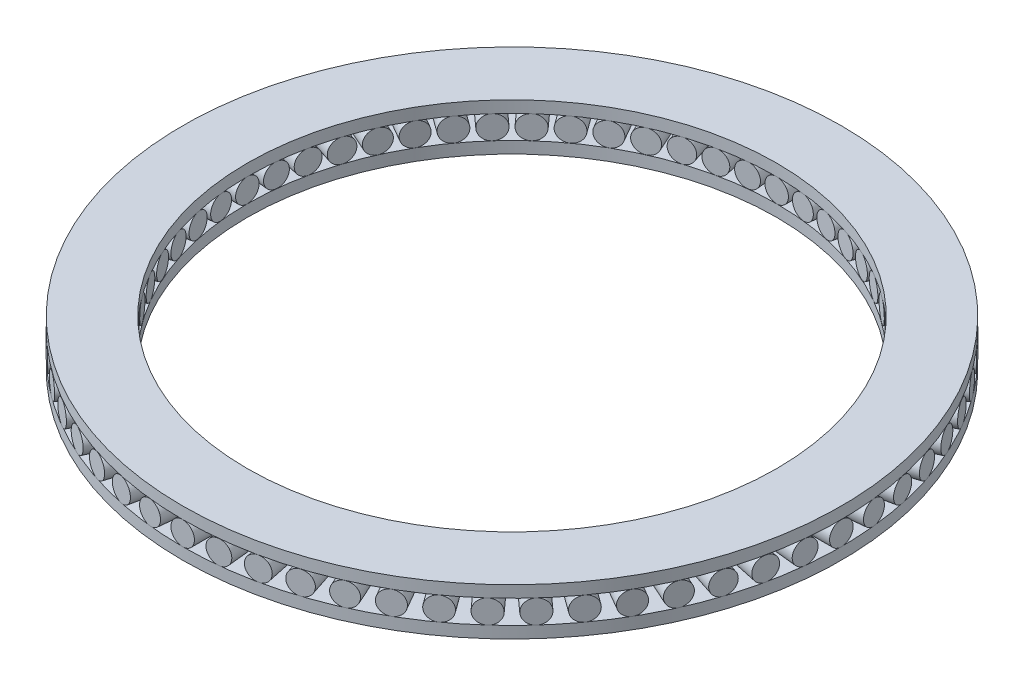
from build123d import *

# Parameters (mm, degrees)
SKETCH_1_R               = 28
SKETCH_1_R_2             = 22.5
EXTRUDE_1_DEPTH          = 1
EXTRUDE_START            = 22.5
SKETCH_2_R               = 1
EXTRUDE_2_DEPTH          = 5.5
PATTERN_CIRCULAR_3_COUNT = 60
EXTRUDE_START_2          = -3
SKETCH_3_R               = 28
SKETCH_3_R_2             = 22.5
EXTRUDE_3_DEPTH          = 1


with BuildPart() as part:
    # 草图1 → 凸台-拉伸1 (new body)
    with BuildSketch(Plane(origin=(0, 0, 0), x_dir=(1, 0, 0), z_dir=(0, 1, 0))):
        with Locations(Location((0, 0, 0), (0, 0, 270))):
            Circle(SKETCH_1_R)
        with Locations(Location((0, 0, 0), (0, 0, 270))):
            Circle(SKETCH_1_R_2, mode=Mode.SUBTRACT)
    extrude(amount=EXTRUDE_1_DEPTH)


with BuildPart() as body_2:
    # 草图2 → 凸台-拉伸2 (new body)
    with BuildSketch(Plane.XY.offset(EXTRUDE_START)):
        with Locations((0, 2)):
            Circle(SKETCH_2_R)
    extrude(amount=EXTRUDE_2_DEPTH)


with BuildPart() as pattern_circular_3_1:
    # 阵列(圆周)3: pattern copy
    add(body_2.part.rotate(Axis((0, 0, 0), (0, 1, 0)), 1 * 360 / PATTERN_CIRCULAR_3_COUNT))


with BuildPart() as pattern_circular_3_2:
    # 阵列(圆周)3: pattern copy
    add(body_2.part.rotate(Axis((0, 0, 0), (0, 1, 0)), 2 * 360 / PATTERN_CIRCULAR_3_COUNT))


with BuildPart() as pattern_circular_3_3:
    # 阵列(圆周)3: pattern copy
    add(body_2.part.rotate(Axis((0, 0, 0), (0, 1, 0)), 3 * 360 / PATTERN_CIRCULAR_3_COUNT))


with BuildPart() as pattern_circular_3_4:
    # 阵列(圆周)3: pattern copy
    add(body_2.part.rotate(Axis((0, 0, 0), (0, 1, 0)), 4 * 360 / PATTERN_CIRCULAR_3_COUNT))


with BuildPart() as pattern_circular_3_5:
    # 阵列(圆周)3: pattern copy
    add(body_2.part.rotate(Axis((0, 0, 0), (0, 1, 0)), 5 * 360 / PATTERN_CIRCULAR_3_COUNT))


with BuildPart() as pattern_circular_3_6:
    # 阵列(圆周)3: pattern copy
    add(body_2.part.rotate(Axis((0, 0, 0), (0, 1, 0)), 6 * 360 / PATTERN_CIRCULAR_3_COUNT))


with BuildPart() as pattern_circular_3_7:
    # 阵列(圆周)3: pattern copy
    add(body_2.part.rotate(Axis((0, 0, 0), (0, 1, 0)), 7 * 360 / PATTERN_CIRCULAR_3_COUNT))


with BuildPart() as pattern_circular_3_8:
    # 阵列(圆周)3: pattern copy
    add(body_2.part.rotate(Axis((0, 0, 0), (0, 1, 0)), 8 * 360 / PATTERN_CIRCULAR_3_COUNT))


with BuildPart() as pattern_circular_3_9:
    # 阵列(圆周)3: pattern copy
    add(body_2.part.rotate(Axis((0, 0, 0), (0, 1, 0)), 9 * 360 / PATTERN_CIRCULAR_3_COUNT))


with BuildPart() as pattern_circular_3_10:
    # 阵列(圆周)3: pattern copy
    add(body_2.part.rotate(Axis((0, 0, 0), (0, 1, 0)), 10 * 360 / PATTERN_CIRCULAR_3_COUNT))


with BuildPart() as pattern_circular_3_11:
    # 阵列(圆周)3: pattern copy
    add(body_2.part.rotate(Axis((0, 0, 0), (0, 1, 0)), 11 * 360 / PATTERN_CIRCULAR_3_COUNT))


with BuildPart() as pattern_circular_3_12:
    # 阵列(圆周)3: pattern copy
    add(body_2.part.rotate(Axis((0, 0, 0), (0, 1, 0)), 12 * 360 / PATTERN_CIRCULAR_3_COUNT))


with BuildPart() as pattern_circular_3_13:
    # 阵列(圆周)3: pattern copy
    add(body_2.part.rotate(Axis((0, 0, 0), (0, 1, 0)), 13 * 360 / PATTERN_CIRCULAR_3_COUNT))


with BuildPart() as pattern_circular_3_14:
    # 阵列(圆周)3: pattern copy
    add(body_2.part.rotate(Axis((0, 0, 0), (0, 1, 0)), 14 * 360 / PATTERN_CIRCULAR_3_COUNT))


with BuildPart() as pattern_circular_3_15:
    # 阵列(圆周)3: pattern copy
    add(body_2.part.rotate(Axis((0, 0, 0), (0, 1, 0)), 15 * 360 / PATTERN_CIRCULAR_3_COUNT))


with BuildPart() as pattern_circular_3_16:
    # 阵列(圆周)3: pattern copy
    add(body_2.part.rotate(Axis((0, 0, 0), (0, 1, 0)), 16 * 360 / PATTERN_CIRCULAR_3_COUNT))


with BuildPart() as pattern_circular_3_17:
    # 阵列(圆周)3: pattern copy
    add(body_2.part.rotate(Axis((0, 0, 0), (0, 1, 0)), 17 * 360 / PATTERN_CIRCULAR_3_COUNT))


with BuildPart() as pattern_circular_3_18:
    # 阵列(圆周)3: pattern copy
    add(body_2.part.rotate(Axis((0, 0, 0), (0, 1, 0)), 18 * 360 / PATTERN_CIRCULAR_3_COUNT))


with BuildPart() as pattern_circular_3_19:
    # 阵列(圆周)3: pattern copy
    add(body_2.part.rotate(Axis((0, 0, 0), (0, 1, 0)), 19 * 360 / PATTERN_CIRCULAR_3_COUNT))


with BuildPart() as pattern_circular_3_20:
    # 阵列(圆周)3: pattern copy
    add(body_2.part.rotate(Axis((0, 0, 0), (0, 1, 0)), 20 * 360 / PATTERN_CIRCULAR_3_COUNT))


with BuildPart() as pattern_circular_3_21:
    # 阵列(圆周)3: pattern copy
    add(body_2.part.rotate(Axis((0, 0, 0), (0, 1, 0)), 21 * 360 / PATTERN_CIRCULAR_3_COUNT))


with BuildPart() as pattern_circular_3_22:
    # 阵列(圆周)3: pattern copy
    add(body_2.part.rotate(Axis((0, 0, 0), (0, 1, 0)), 22 * 360 / PATTERN_CIRCULAR_3_COUNT))


with BuildPart() as pattern_circular_3_23:
    # 阵列(圆周)3: pattern copy
    add(body_2.part.rotate(Axis((0, 0, 0), (0, 1, 0)), 23 * 360 / PATTERN_CIRCULAR_3_COUNT))


with BuildPart() as pattern_circular_3_24:
    # 阵列(圆周)3: pattern copy
    add(body_2.part.rotate(Axis((0, 0, 0), (0, 1, 0)), 24 * 360 / PATTERN_CIRCULAR_3_COUNT))


with BuildPart() as pattern_circular_3_25:
    # 阵列(圆周)3: pattern copy
    add(body_2.part.rotate(Axis((0, 0, 0), (0, 1, 0)), 25 * 360 / PATTERN_CIRCULAR_3_COUNT))


with BuildPart() as pattern_circular_3_26:
    # 阵列(圆周)3: pattern copy
    add(body_2.part.rotate(Axis((0, 0, 0), (0, 1, 0)), 26 * 360 / PATTERN_CIRCULAR_3_COUNT))


with BuildPart() as pattern_circular_3_27:
    # 阵列(圆周)3: pattern copy
    add(body_2.part.rotate(Axis((0, 0, 0), (0, 1, 0)), 27 * 360 / PATTERN_CIRCULAR_3_COUNT))


with BuildPart() as pattern_circular_3_28:
    # 阵列(圆周)3: pattern copy
    add(body_2.part.rotate(Axis((0, 0, 0), (0, 1, 0)), 28 * 360 / PATTERN_CIRCULAR_3_COUNT))


with BuildPart() as pattern_circular_3_29:
    # 阵列(圆周)3: pattern copy
    add(body_2.part.rotate(Axis((0, 0, 0), (0, 1, 0)), 29 * 360 / PATTERN_CIRCULAR_3_COUNT))


with BuildPart() as pattern_circular_3_30:
    # 阵列(圆周)3: pattern copy
    add(body_2.part.rotate(Axis((0, 0, 0), (0, 1, 0)), 30 * 360 / PATTERN_CIRCULAR_3_COUNT))


with BuildPart() as pattern_circular_3_31:
    # 阵列(圆周)3: pattern copy
    add(body_2.part.rotate(Axis((0, 0, 0), (0, 1, 0)), 31 * 360 / PATTERN_CIRCULAR_3_COUNT))


with BuildPart() as pattern_circular_3_32:
    # 阵列(圆周)3: pattern copy
    add(body_2.part.rotate(Axis((0, 0, 0), (0, 1, 0)), 32 * 360 / PATTERN_CIRCULAR_3_COUNT))


with BuildPart() as pattern_circular_3_33:
    # 阵列(圆周)3: pattern copy
    add(body_2.part.rotate(Axis((0, 0, 0), (0, 1, 0)), 33 * 360 / PATTERN_CIRCULAR_3_COUNT))


with BuildPart() as pattern_circular_3_34:
    # 阵列(圆周)3: pattern copy
    add(body_2.part.rotate(Axis((0, 0, 0), (0, 1, 0)), 34 * 360 / PATTERN_CIRCULAR_3_COUNT))


with BuildPart() as pattern_circular_3_35:
    # 阵列(圆周)3: pattern copy
    add(body_2.part.rotate(Axis((0, 0, 0), (0, 1, 0)), 35 * 360 / PATTERN_CIRCULAR_3_COUNT))


with BuildPart() as pattern_circular_3_36:
    # 阵列(圆周)3: pattern copy
    add(body_2.part.rotate(Axis((0, 0, 0), (0, 1, 0)), 36 * 360 / PATTERN_CIRCULAR_3_COUNT))


with BuildPart() as pattern_circular_3_37:
    # 阵列(圆周)3: pattern copy
    add(body_2.part.rotate(Axis((0, 0, 0), (0, 1, 0)), 37 * 360 / PATTERN_CIRCULAR_3_COUNT))


with BuildPart() as pattern_circular_3_38:
    # 阵列(圆周)3: pattern copy
    add(body_2.part.rotate(Axis((0, 0, 0), (0, 1, 0)), 38 * 360 / PATTERN_CIRCULAR_3_COUNT))


with BuildPart() as pattern_circular_3_39:
    # 阵列(圆周)3: pattern copy
    add(body_2.part.rotate(Axis((0, 0, 0), (0, 1, 0)), 39 * 360 / PATTERN_CIRCULAR_3_COUNT))


with BuildPart() as pattern_circular_3_40:
    # 阵列(圆周)3: pattern copy
    add(body_2.part.rotate(Axis((0, 0, 0), (0, 1, 0)), 40 * 360 / PATTERN_CIRCULAR_3_COUNT))


with BuildPart() as pattern_circular_3_41:
    # 阵列(圆周)3: pattern copy
    add(body_2.part.rotate(Axis((0, 0, 0), (0, 1, 0)), 41 * 360 / PATTERN_CIRCULAR_3_COUNT))


with BuildPart() as pattern_circular_3_42:
    # 阵列(圆周)3: pattern copy
    add(body_2.part.rotate(Axis((0, 0, 0), (0, 1, 0)), 42 * 360 / PATTERN_CIRCULAR_3_COUNT))


with BuildPart() as pattern_circular_3_43:
    # 阵列(圆周)3: pattern copy
    add(body_2.part.rotate(Axis((0, 0, 0), (0, 1, 0)), 43 * 360 / PATTERN_CIRCULAR_3_COUNT))


with BuildPart() as pattern_circular_3_44:
    # 阵列(圆周)3: pattern copy
    add(body_2.part.rotate(Axis((0, 0, 0), (0, 1, 0)), 44 * 360 / PATTERN_CIRCULAR_3_COUNT))


with BuildPart() as pattern_circular_3_45:
    # 阵列(圆周)3: pattern copy
    add(body_2.part.rotate(Axis((0, 0, 0), (0, 1, 0)), 45 * 360 / PATTERN_CIRCULAR_3_COUNT))


with BuildPart() as pattern_circular_3_46:
    # 阵列(圆周)3: pattern copy
    add(body_2.part.rotate(Axis((0, 0, 0), (0, 1, 0)), 46 * 360 / PATTERN_CIRCULAR_3_COUNT))


with BuildPart() as pattern_circular_3_47:
    # 阵列(圆周)3: pattern copy
    add(body_2.part.rotate(Axis((0, 0, 0), (0, 1, 0)), 47 * 360 / PATTERN_CIRCULAR_3_COUNT))


with BuildPart() as pattern_circular_3_48:
    # 阵列(圆周)3: pattern copy
    add(body_2.part.rotate(Axis((0, 0, 0), (0, 1, 0)), 48 * 360 / PATTERN_CIRCULAR_3_COUNT))


with BuildPart() as pattern_circular_3_49:
    # 阵列(圆周)3: pattern copy
    add(body_2.part.rotate(Axis((0, 0, 0), (0, 1, 0)), 49 * 360 / PATTERN_CIRCULAR_3_COUNT))


with BuildPart() as pattern_circular_3_50:
    # 阵列(圆周)3: pattern copy
    add(body_2.part.rotate(Axis((0, 0, 0), (0, 1, 0)), 50 * 360 / PATTERN_CIRCULAR_3_COUNT))


with BuildPart() as pattern_circular_3_51:
    # 阵列(圆周)3: pattern copy
    add(body_2.part.rotate(Axis((0, 0, 0), (0, 1, 0)), 51 * 360 / PATTERN_CIRCULAR_3_COUNT))


with BuildPart() as pattern_circular_3_52:
    # 阵列(圆周)3: pattern copy
    add(body_2.part.rotate(Axis((0, 0, 0), (0, 1, 0)), 52 * 360 / PATTERN_CIRCULAR_3_COUNT))


with BuildPart() as pattern_circular_3_53:
    # 阵列(圆周)3: pattern copy
    add(body_2.part.rotate(Axis((0, 0, 0), (0, 1, 0)), 53 * 360 / PATTERN_CIRCULAR_3_COUNT))


with BuildPart() as pattern_circular_3_54:
    # 阵列(圆周)3: pattern copy
    add(body_2.part.rotate(Axis((0, 0, 0), (0, 1, 0)), 54 * 360 / PATTERN_CIRCULAR_3_COUNT))


with BuildPart() as pattern_circular_3_55:
    # 阵列(圆周)3: pattern copy
    add(body_2.part.rotate(Axis((0, 0, 0), (0, 1, 0)), 55 * 360 / PATTERN_CIRCULAR_3_COUNT))


with BuildPart() as pattern_circular_3_56:
    # 阵列(圆周)3: pattern copy
    add(body_2.part.rotate(Axis((0, 0, 0), (0, 1, 0)), 56 * 360 / PATTERN_CIRCULAR_3_COUNT))


with BuildPart() as pattern_circular_3_57:
    # 阵列(圆周)3: pattern copy
    add(body_2.part.rotate(Axis((0, 0, 0), (0, 1, 0)), 57 * 360 / PATTERN_CIRCULAR_3_COUNT))


with BuildPart() as pattern_circular_3_58:
    # 阵列(圆周)3: pattern copy
    add(body_2.part.rotate(Axis((0, 0, 0), (0, 1, 0)), 58 * 360 / PATTERN_CIRCULAR_3_COUNT))


with BuildPart() as pattern_circular_3_59:
    # 阵列(圆周)3: pattern copy
    add(body_2.part.rotate(Axis((0, 0, 0), (0, 1, 0)), 59 * 360 / PATTERN_CIRCULAR_3_COUNT))


with BuildPart() as body_62:
    # 草图3 → 凸台-拉伸3 (new body)
    with BuildSketch(Plane.XZ.offset(EXTRUDE_START_2)):
        with Locations(Location((0, 0, 0), (0, 0, 270))):
            Circle(SKETCH_3_R)
        with Locations(Location((0, 0, 0), (0, 0, 270))):
            Circle(SKETCH_3_R_2, mode=Mode.SUBTRACT)
    extrude(amount=-EXTRUDE_3_DEPTH)


solid = Compound([part.part, body_2.part, pattern_circular_3_1.part, pattern_circular_3_2.part, pattern_circular_3_3.part, pattern_circular_3_4.part, pattern_circular_3_5.part, pattern_circular_3_6.part, pattern_circular_3_7.part, pattern_circular_3_8.part, pattern_circular_3_9.part, pattern_circular_3_10.part, pattern_circular_3_11.part, pattern_circular_3_12.part, pattern_circular_3_13.part, pattern_circular_3_14.part, pattern_circular_3_15.part, pattern_circular_3_16.part, pattern_circular_3_17.part, pattern_circular_3_18.part, pattern_circular_3_19.part, pattern_circular_3_20.part, pattern_circular_3_21.part, pattern_circular_3_22.part, pattern_circular_3_23.part, pattern_circular_3_24.part, pattern_circular_3_25.part, pattern_circular_3_26.part, pattern_circular_3_27.part, pattern_circular_3_28.part, pattern_circular_3_29.part, pattern_circular_3_30.part, pattern_circular_3_31.part, pattern_circular_3_32.part, pattern_circular_3_33.part, pattern_circular_3_34.part, pattern_circular_3_35.part, pattern_circular_3_36.part, pattern_circular_3_37.part, pattern_circular_3_38.part, pattern_circular_3_39.part, pattern_circular_3_40.part, pattern_circular_3_41.part, pattern_circular_3_42.part, pattern_circular_3_43.part, pattern_circular_3_44.part, pattern_circular_3_45.part, pattern_circular_3_46.part, pattern_circular_3_47.part, pattern_circular_3_48.part, pattern_circular_3_49.part, pattern_circular_3_50.part, pattern_circular_3_51.part, pattern_circular_3_52.part, pattern_circular_3_53.part, pattern_circular_3_54.part, pattern_circular_3_55.part, pattern_circular_3_56.part, pattern_circular_3_57.part, pattern_circular_3_58.part, pattern_circular_3_59.part, body_62.part])
